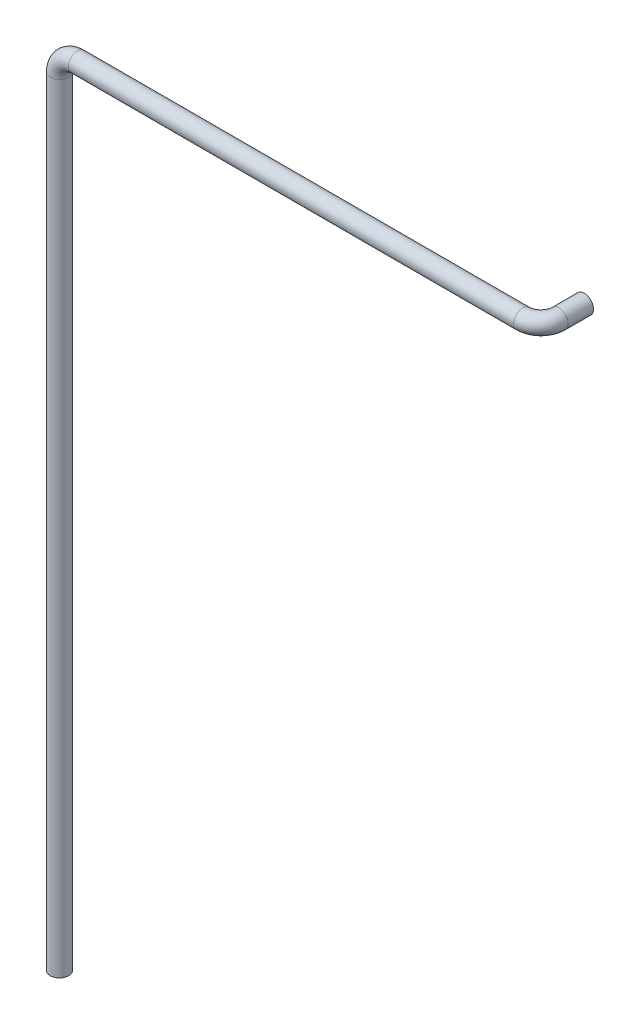
from build123d import *

# Parameters (mm, degrees)
CROQUIS1_R              = 12.7
SALIENTE_EXTRUIR1_DEPTH = 860
CROQUIS2_R              = 12.7


with BuildPart() as part:
    # Croquis1 → Saliente-Extruir1 (new body)
    with BuildSketch(Plane(origin=(0, 0, 0), x_dir=(1, 0, 0), z_dir=(0, 1, 0))):
        with Locations(Location((0, 0, 0), (0, 0, 270))):
            Circle(CROQUIS1_R)
    extrude(amount=SALIENTE_EXTRUIR1_DEPTH)

    # Barrer1: sweep along a curve in space
    with BuildLine() as barrer1_path:
        Line((0, 860, 0), (0, 1075, 0))
        ThreePointArc((0, 1075, 0), (7.32233047, 1092.67766953, 0), (25, 1100, 0))
        Line((25, 1100, 0), (640, 1100, 0))
        ThreePointArc((640, 1100, 0), (657.67766953, 1100, -7.32233047), (665, 1100, -25))
        Line((665, 1100, -25), (665, 1100, -60))
    # Croquis2 → Barrer1 (sweep)
    with BuildSketch(Plane(origin=(0, 860, 0), x_dir=(1, 0, 0), z_dir=(0, 1, 0))):
        Circle(CROQUIS2_R)
    sweep(path=barrer1_path.line)


solid = part.part
